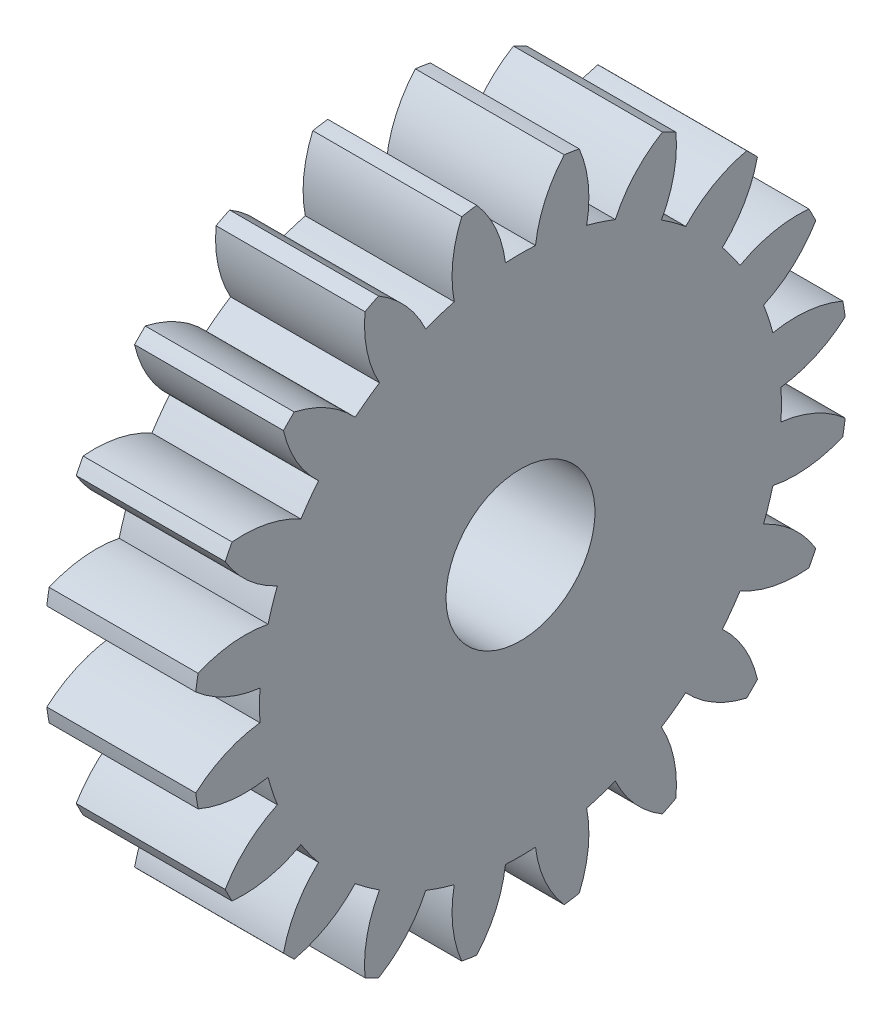
from build123d import *

# Parameters (mm, degrees)
BASPROSKE_W     = 6.35
BASPROSKE_H     = 13.97
TOOTHCUT_DEPTH  = 21.751970991
TEETHCUTS_COUNT = 20
TEETHCUTS_ANGLE = 342
BORSKE_R        = 3.175
BORE_DEPTH      = 50.8000508


with BuildPart() as part:
    # BasProSke → Base-Revolve (revolve)
    with BuildSketch(Plane(origin=(0, 0, 0), x_dir=(1, 0, 0), z_dir=(0, 1, 0)), mode=Mode.PRIVATE) as base_revolve_sk:
        with Locations((3.175, 6.985)):
            Rectangle(BASPROSKE_W, BASPROSKE_H)
    revolve(base_revolve_sk.sketch.rotate(Axis((-10, 0, 0), (1, 0, 0)), 180), axis=Axis((-10, 0, 0), (1, 0, 0)))

    # TooCutSke → ToothCut (cut, through all)
    with BuildSketch(Plane(origin=(0, 0, 0), x_dir=(0, 0, -1), z_dir=(1, 0, 0))):
        with BuildLine():
            ThreePointArc((0.64046545, 11.106749257), (0, 11.1252), (-0.64046545, 11.106749257))
            ThreePointArc((-0.64046545, 11.106749257), (-1.052455812, 12.582227662), (-1.8855699, 13.867798935))
            ThreePointArc((-1.8855699, 13.867798935), (0, 13.9954), (1.8855699, 13.867798935))
            ThreePointArc((1.8855699, 13.867798935), (1.052455812, 12.582227662), (0.64046545, 11.106749257))
        make_face()
    toothcut = extrude(amount=TOOTHCUT_DEPTH, mode=Mode.SUBTRACT)

    # TeethCuts: ToothCut ×20 about axis
    teethcuts_axis = Axis((-10, 0, 0), (1, 0, 0))
    for i in range(1, TEETHCUTS_COUNT):
        add(toothcut.rotate(teethcuts_axis, i * TEETHCUTS_ANGLE / (TEETHCUTS_COUNT - 1)), mode=Mode.SUBTRACT)

    # BorSke → Bore (cut, symmetric)
    with BuildSketch(Plane(origin=(0, 0, 0), x_dir=(0, 0, -1), z_dir=(1, 0, 0))):
        with Locations(Location((0, 0, 0), (0, 0, 180))):
            Circle(BORSKE_R)
    extrude(amount=BORE_DEPTH, both=True, mode=Mode.SUBTRACT)


solid = part.part
